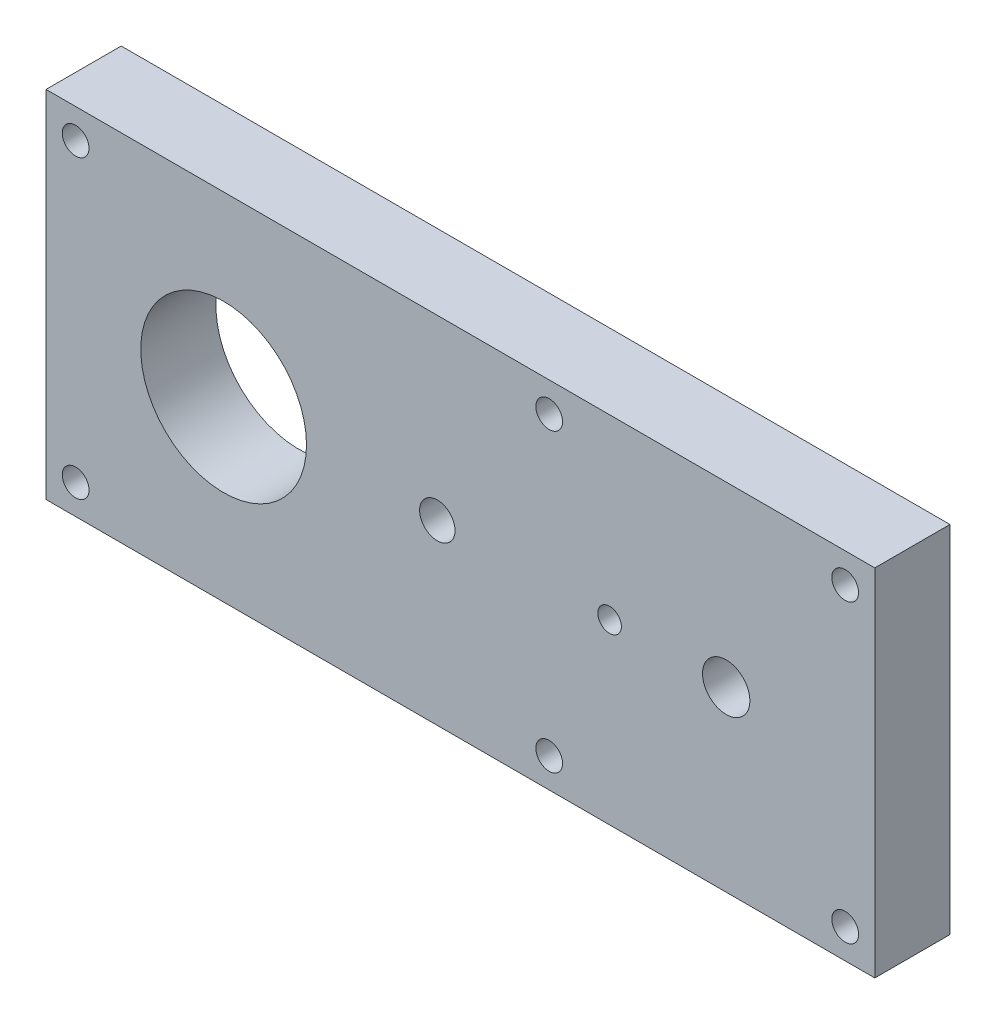
from build123d import *

# Parameters (mm, degrees)
SKETCH1_W             = 70
SKETCH1_H             = 30
SKETCH1_R             = 7
SKETCH1_R_2           = 1.495
SKETCH1_R_3           = 0.995
SKETCH1_R_4           = 2
BOSS_EXTRUDE1_DEPTH   = 6.35
F_2_CLEARANCE_HOLE1_D = 2.2606


with BuildPart() as part:
    # Sketch1 → Boss-Extrude1 (new body)
    with BuildSketch(Plane.XY):
        with Locations((20, 0)):
            Rectangle(SKETCH1_W, SKETCH1_H)
        Circle(SKETCH1_R, mode=Mode.SUBTRACT)
        with Locations((18.05, 0)):
            Circle(SKETCH1_R_2, mode=Mode.SUBTRACT)
        with Locations((32.6, 0)):
            Circle(SKETCH1_R_3, mode=Mode.SUBTRACT)
        with Locations((42.449999958, 0)):
            Circle(SKETCH1_R_4, mode=Mode.SUBTRACT)
    extrude(amount=BOSS_EXTRUDE1_DEPTH)

    # #2 Clearance Hole1 (through all)
    with Locations(Plane.XY.offset(6.35)):
        with Locations((-12.5, 12.5), (-12.5, -12.5), (27.5, 12.5), (27.5, -12.5), (52.5, 12.5), (52.5, -12.5)):
            Hole(F_2_CLEARANCE_HOLE1_D / 2)


solid = part.part
